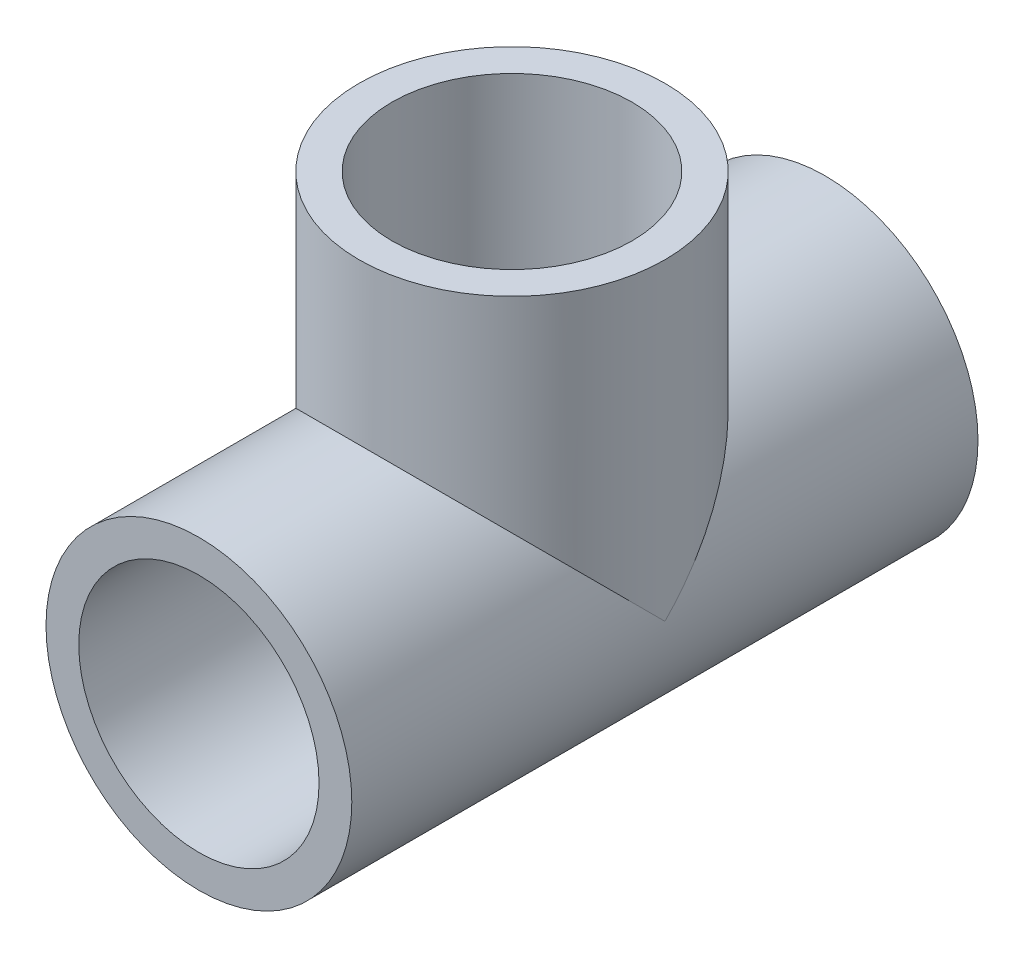
from build123d import *

# Parameters (mm, degrees)
SKETCH1_W               = 16.66875
SKETCH1_H               = 68.2625
SKETCH2_W               = 16.66875
SKETCH2_H               = 34.13125
SKETCH7_R               = 12.7
CUT_EXTRUDE1_DEPTH      = 79.11887326
CUT_EXTRUDE2_REACH      = 65.431
CUT_EXTRUDE2_END_RADIUS = 12.7
SKETCH8_R               = 12.7
SKETCH9_R               = 13.096875
CUT_EXTRUDE3_DEPTH      = 19.05
CUT_EXTRUDE4_START      = -19.05
SKETCH10_R              = 13.096875
CUT_EXTRUDE4_DEPTH      = 19.05
SKETCH11_R              = 13.096875
CUT_EXTRUDE5_DEPTH      = 19.05


with BuildPart() as part:
    # Sketch1 → Revolve1 (revolve)
    with BuildSketch(Plane(origin=(0, 0, 0), x_dir=(1, 0, 0), z_dir=(0, 1, 0)), mode=Mode.PRIVATE) as revolve1_sk:
        with Locations((8.334375, 0)):
            Rectangle(SKETCH1_W, SKETCH1_H)
    revolve(revolve1_sk.sketch.rotate(Axis((0, 0, 118.243982537), (0, 0, -1)), 180), axis=Axis((0, 0, 118.243982537), (0, 0, -1)))

    # Sketch2 → Revolve2 (revolve)
    with BuildSketch(Plane.XY, mode=Mode.PRIVATE) as revolve2_sk:
        with Locations((-8.334375, 17.065625)):
            Rectangle(SKETCH2_W, SKETCH2_H)
    revolve(revolve2_sk.sketch.rotate(Axis((0, 0, 0), (0, 1, 0)), 90), axis=Axis((0, 0, 0), (0, 1, 0)))

    # Sketch7 → Cut-Extrude1 (cut, through all)
    with BuildSketch(Plane.XY.offset(34.13125)):
        Circle(SKETCH7_R)
    extrude(amount=-CUT_EXTRUDE1_DEPTH, mode=Mode.SUBTRACT)

    # Cut-Extrude2: up to this cylinder (the profile starts outside it)
    cut_extrude2_end = Plane(origin=(0, 0, 0), z_dir=(0, 0, 1)) * Cylinder(CUT_EXTRUDE2_END_RADIUS, 157.262, mode=Mode.PRIVATE)
    # Sketch8 → Cut-Extrude2 (cut, up to the surface)
    with BuildSketch(Plane(origin=(0, 34.13125, 0), x_dir=(1, 0, 0), z_dir=(0, 1, 0)), mode=Mode.PRIVATE) as cut_extrude2_sk1:
        with Locations(Location((0, 0, 0), (0, 0, 270))):
            Circle(SKETCH8_R)
    cut_extrude2_tool1 = extrude(cut_extrude2_sk1.sketch, amount=-CUT_EXTRUDE2_REACH, mode=Mode.PRIVATE) - cut_extrude2_end
    add(cut_extrude2_tool1.solids().sort_by_distance((0, 34.13125, 0))[0], mode=Mode.SUBTRACT)

    # Sketch9 → Cut-Extrude3 (cut)
    with BuildSketch(Plane.XY.offset(34.13125)):
        Circle(SKETCH9_R)
    extrude(amount=-CUT_EXTRUDE3_DEPTH, mode=Mode.SUBTRACT)

    # Sketch10 → Cut-Extrude4 (cut)
    with BuildSketch(Plane(origin=(0, 0, -34.13125), x_dir=(-1, 0, 0), z_dir=(0, 0, -1)).offset(CUT_EXTRUDE4_START)):
        with Locations(Location((0, 0, 0), (0, 0, 180))):
            Circle(SKETCH10_R)
    extrude(amount=CUT_EXTRUDE4_DEPTH, mode=Mode.SUBTRACT)

    # Sketch11 → Cut-Extrude5 (cut)
    with BuildSketch(Plane(origin=(0, 34.13125, 0), x_dir=(1, 0, 0), z_dir=(0, 1, 0))):
        with Locations(Location((0, 0, 0), (0, 0, 270))):
            Circle(SKETCH11_R)
    extrude(amount=-CUT_EXTRUDE5_DEPTH, mode=Mode.SUBTRACT)


solid = part.part
